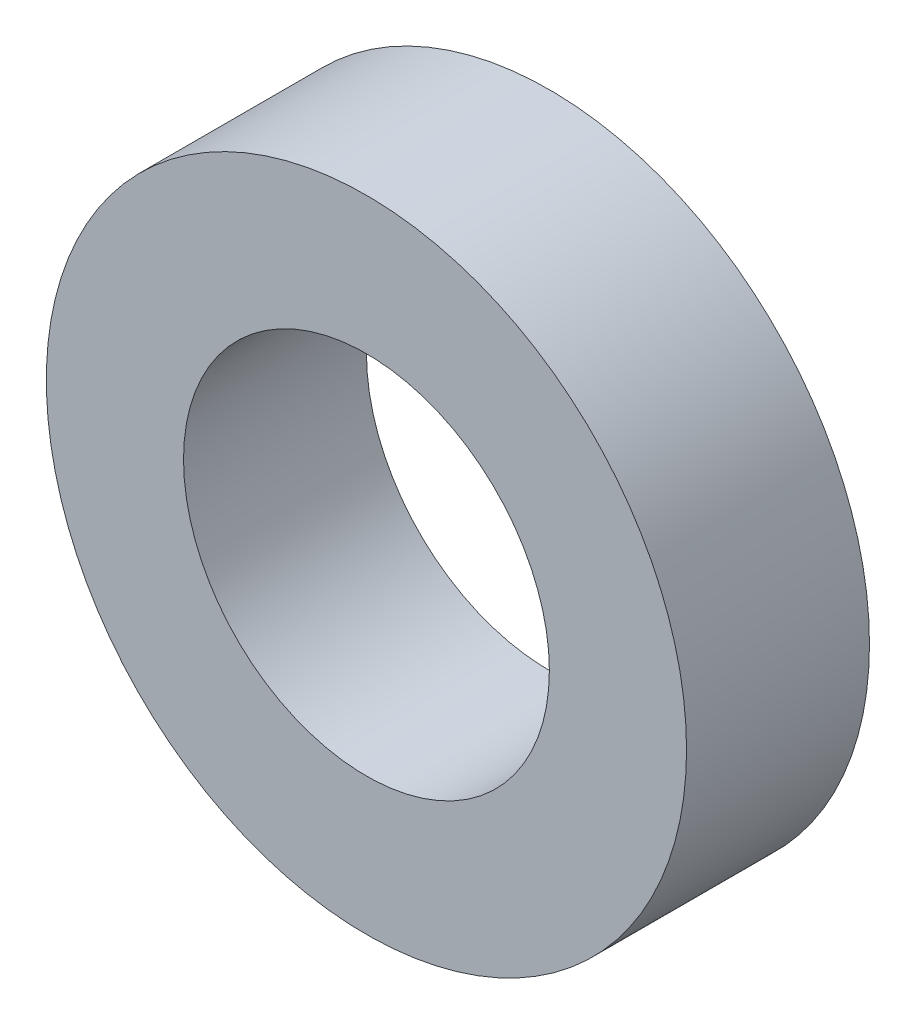
from build123d import *

# Parameters (mm, degrees)
SKETCH1_R           = 7
SKETCH1_R_2         = 4
BOSS_EXTRUDE1_DEPTH = 4


with BuildPart() as part:
    # Sketch1 → Boss-Extrude1 (new body)
    with BuildSketch(Plane.XY):
        Circle(SKETCH1_R)
        Circle(SKETCH1_R_2, mode=Mode.SUBTRACT)
    extrude(amount=BOSS_EXTRUDE1_DEPTH)


solid = part.part
